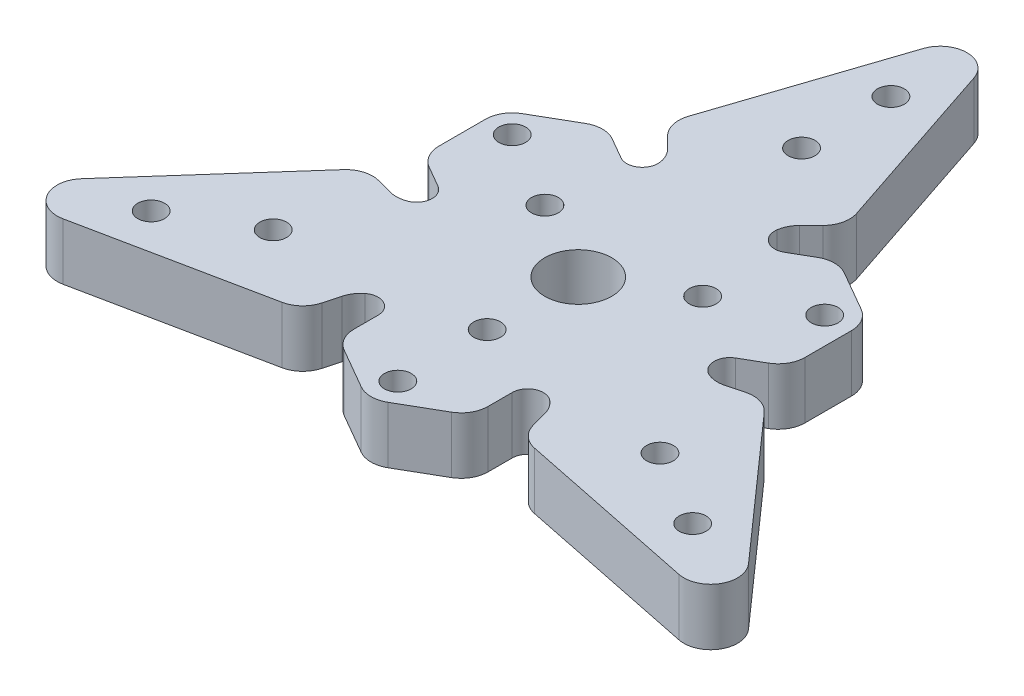
from build123d import *

# Parameters (mm, degrees)
SKETCH1_R             = 7.5
SKETCH1_R_2           = 3
BOSS_EXTRUDE1_DEPTH   = 12.7
CROQUIS1_R            = 5.5
CORTAR_EXTRUIR1_DEPTH = 6


with BuildPart() as part:
    # Sketch1 → Boss-Extrude1 (new body)
    with BuildSketch(Plane(origin=(0, 0, 0), x_dir=(1, 0, 0), z_dir=(0, 1, 0))):
        with BuildLine():
            Line((5.692099788, 82.923700635), (18.827362954, 43.517911137))
            ThreePointArc((18.827362954, 43.517911137), (18.974757103, 40.242027017), (17.377903853, 37.377903853))
            Line((17.377903853, 37.377903853), (14.796225796, 34.796225796))
            ThreePointArc((14.796225796, 34.796225796), (13.683042429, 33.258238267), (13.106123272, 31.449441115))
            ThreePointArc((13.106123272, 31.449441115), (14.594879432, 28.035289019), (18.316890145, 27.895769532))
            Line((18.316890145, 27.895769532), (22.980762114, 30.588457268))
            ThreePointArc((22.980762114, 30.588457268), (25.980762114, 31.392304845), (28.980762114, 30.588457268))
            Line((28.980762114, 30.588457268), (37.980762114, 25.392304845))
            ThreePointArc((37.980762114, 25.392304845), (40.176914536, 23.196152423), (40.980762114, 20.196152423))
            Line((40.980762114, 20.196152423), (40.980762114, 9.803847577))
            ThreePointArc((40.980762114, 9.803847577), (40.176914536, 6.803847577), (37.980762114, 4.607695155))
            Line((37.980762114, 4.607695155), (33.316890145, 1.915007418))
            ThreePointArc((33.316890145, 1.915007418), (31.576712209, -1.378108157), (33.789076576, -4.374484859))
            ThreePointArc((33.789076576, -4.374484859), (35.644000439, -4.779256788), (37.532528394, -4.584205478))
            Line((37.532528394, -4.584205478), (41.059166204, -3.639245725))
            ThreePointArc((41.059166204, -3.639245725), (44.337996248, -3.688391827), (47.101298041, -5.453980963))
            Line((47.101298041, -5.453980963), (74.66008122, -36.5323473))
            ThreePointArc((74.66008122, -36.5323473), (75.367016076, -43.513167019), (68.967981432, -46.391353335))
            Line((68.967981432, -46.391353335), (28.273935087, -38.063930173))
            ThreePointArc((28.273935087, -38.063930173), (25.363239145, -36.55363519), (23.681262351, -33.738658128))
            Line((23.681262351, -33.738658128), (22.736302597, -30.212020318))
            ThreePointArc((22.736302597, -30.212020318), (21.960958009, -28.478981478), (20.682953305, -27.074956256))
            ThreePointArc((20.682953305, -27.074956256), (16.981832777, -26.657180862), (15, -29.81077695))
            Line((15, -29.81077695), (15, -35.196152423))
            ThreePointArc((15, -35.196152423), (14.196152423, -38.196152423), (12, -40.392304845))
            Line((12, -40.392304845), (3, -45.588457268))
            ThreePointArc((3, -45.588457268), (0, -46.392304845), (-3, -45.588457268))
            Line((-3, -45.588457268), (-12, -40.392304845))
            ThreePointArc((-12, -40.392304845), (-14.196152423, -38.196152423), (-15, -35.196152423))
            Line((-15, -35.196152423), (-15, -29.81077695))
            ThreePointArc((-15, -29.81077695), (-16.981832777, -26.657180862), (-20.682953305, -27.074956256))
            ThreePointArc((-20.682953305, -27.074956256), (-21.960958009, -28.478981478), (-22.736302597, -30.212020318))
            Line((-22.736302597, -30.212020318), (-23.681262351, -33.738658128))
            ThreePointArc((-23.681262351, -33.738658128), (-25.363239145, -36.55363519), (-28.273935087, -38.063930173))
            Line((-28.273935087, -38.063930173), (-68.967981432, -46.391353335))
            ThreePointArc((-68.967981432, -46.391353335), (-75.367016076, -43.51316702), (-74.66008122, -36.5323473))
            Line((-74.66008122, -36.5323473), (-47.101298041, -5.453980963))
            ThreePointArc((-47.101298041, -5.453980963), (-44.337996248, -3.688391827), (-41.059166204, -3.639245725))
            Line((-41.059166204, -3.639245725), (-37.532528394, -4.584205478))
            ThreePointArc((-37.532528394, -4.584205478), (-35.644000439, -4.779256788), (-33.789076576, -4.374484859))
            ThreePointArc((-33.789076576, -4.374484859), (-31.576712209, -1.378108157), (-33.316890145, 1.915007418))
            Line((-33.316890145, 1.915007418), (-37.980762114, 4.607695155))
            ThreePointArc((-37.980762114, 4.607695155), (-40.176914536, 6.803847577), (-40.980762114, 9.803847577))
            Line((-40.980762114, 9.803847577), (-40.980762114, 20.196152423))
            ThreePointArc((-40.980762114, 20.196152423), (-40.176914536, 23.196152423), (-37.980762114, 25.392304845))
            Line((-37.980762114, 25.392304845), (-28.980762114, 30.588457268))
            ThreePointArc((-28.980762114, 30.588457268), (-25.980762114, 31.392304845), (-22.980762114, 30.588457268))
            Line((-22.980762114, 30.588457268), (-18.316890145, 27.895769532))
            ThreePointArc((-18.316890145, 27.895769532), (-14.594879432, 28.035289019), (-13.106123272, 31.449441115))
            ThreePointArc((-13.106123272, 31.449441115), (-13.683042429, 33.258238267), (-14.796225796, 34.796225796))
            Line((-14.796225796, 34.796225796), (-17.377903853, 37.377903853))
            ThreePointArc((-17.377903853, 37.377903853), (-18.974757103, 40.242027017), (-18.827362954, 43.517911137))
            Line((-18.827362954, 43.517911137), (-5.692099788, 82.923700635))
            ThreePointArc((-5.692099788, 82.923700635), (0, 87.026334039), (5.692099788, 82.923700635))
        make_face()
        with Locations(Location((0, 0, 0), (0, 0, 270))):
            Circle(SKETCH1_R, mode=Mode.SUBTRACT)
        with Locations(Location((0, 70, 0), (0, 0, 270))):
            Circle(SKETCH1_R_2, mode=Mode.SUBTRACT)
        with Locations(Location((0, 50, 0), (0, 0, 270))):
            Circle(SKETCH1_R_2, mode=Mode.SUBTRACT)
        with Locations(Location((60.621778265, -35, 0), (0, 0, 270))):
            Circle(SKETCH1_R_2, mode=Mode.SUBTRACT)
        with Locations(Location((43.301270189, -25, 0), (0, 0, 270))):
            Circle(SKETCH1_R_2, mode=Mode.SUBTRACT)
        with Locations(Location((-60.621778265, -35, 0), (0, 0, 270))):
            Circle(SKETCH1_R_2, mode=Mode.SUBTRACT)
        with Locations(Location((-43.301270189, -25, 0), (0, 0, 270))):
            Circle(SKETCH1_R_2, mode=Mode.SUBTRACT)
        with Locations(Location((0, -40.392304845, 0), (0, 0, 270))):
            Circle(SKETCH1_R_2, mode=Mode.SUBTRACT)
        with Locations(Location((0, -20.392304845, 0), (0, 0, 270))):
            Circle(SKETCH1_R_2, mode=Mode.SUBTRACT)
        with Locations(Location((-34.980762114, 20.196152423, 0), (0, 0, 270))):
            Circle(SKETCH1_R_2, mode=Mode.SUBTRACT)
        with Locations(Location((-17.660254038, 10.196152423, 0), (0, 0, 270))):
            Circle(SKETCH1_R_2, mode=Mode.SUBTRACT)
        with Locations(Location((34.980762114, 20.196152423, 0), (0, 0, 270))):
            Circle(SKETCH1_R_2, mode=Mode.SUBTRACT)
        with Locations(Location((17.660254038, 10.196152423, 0), (0, 0, 270))):
            Circle(SKETCH1_R_2, mode=Mode.SUBTRACT)
    extrude(amount=BOSS_EXTRUDE1_DEPTH)

    # Croquis1 → Cortar-Extruir1 (cut)
    with BuildSketch(Plane.XZ):
        with Locations(Location((-60.621778265, 35, 0), (0, 0, 270))):
            Circle(CROQUIS1_R)
        with Locations(Location((-43.301270189, 25, 0), (0, 0, 270))):
            Circle(CROQUIS1_R)
        with Locations(Location((43.301270189, 25, 0), (0, 0, 270))):
            Circle(CROQUIS1_R)
        with Locations(Location((60.621778265, 35, 0), (0, 0, 270))):
            Circle(CROQUIS1_R)
        with Locations(Location((0, -50, 0), (0, 0, 270))):
            Circle(CROQUIS1_R)
        with Locations(Location((0, -70, 0), (0, 0, 270))):
            Circle(CROQUIS1_R)
    extrude(amount=-CORTAR_EXTRUIR1_DEPTH, mode=Mode.SUBTRACT)


solid = part.part
